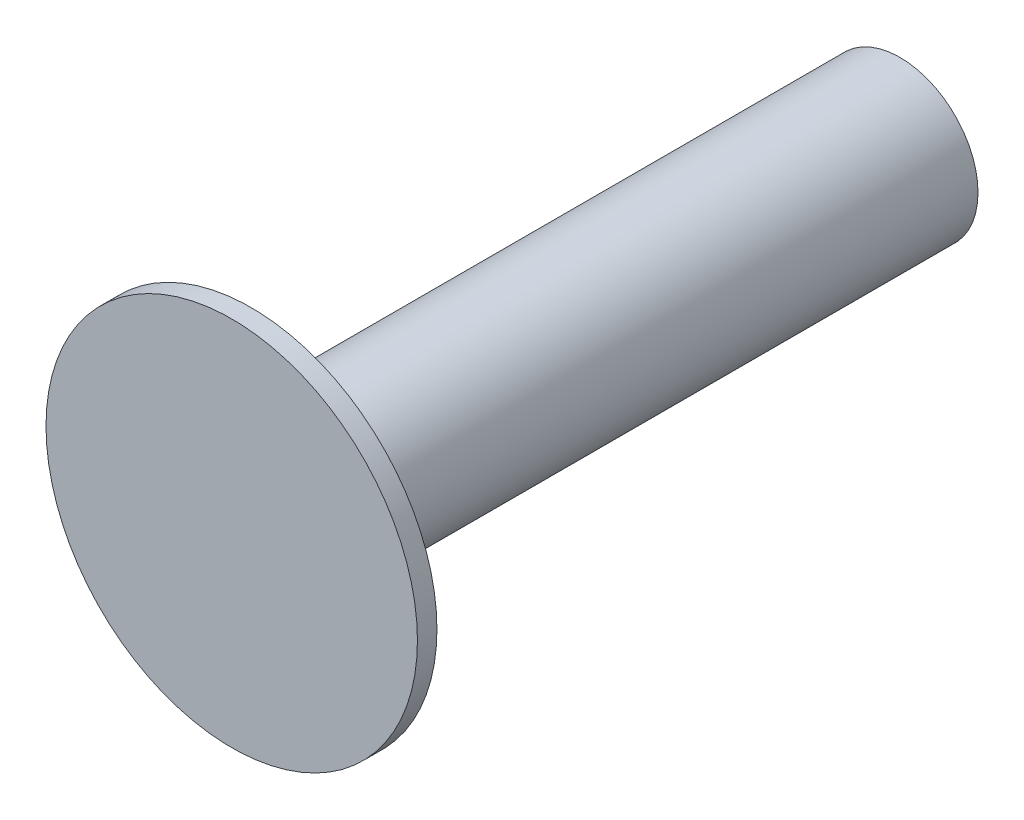
from build123d import *

# Parameters (mm, degrees)
SKETCH1_R           = 4
BOSS_EXTRUDE1_DEPTH = 33.274
SKETCH2_R           = 9.525
BOSS_EXTRUDE2_DEPTH = 1
SKETCH3_R           = 2
CUT_EXTRUDE1_DEPTH  = 15


with BuildPart() as part:
    # Sketch1 → Boss-Extrude1 (new body)
    with BuildSketch(Plane.XY):
        Circle(SKETCH1_R)
    extrude(amount=BOSS_EXTRUDE1_DEPTH)

    # Sketch2 → Boss-Extrude2 (add)
    with BuildSketch(Plane.XY.offset(33.274)):
        Circle(SKETCH2_R)
    extrude(amount=BOSS_EXTRUDE2_DEPTH)

    # Sketch3 → Cut-Extrude1 (cut)
    with BuildSketch(Plane(origin=(0, 0, 0), x_dir=(-1, 0, 0), z_dir=(0, 0, -1))):
        Circle(SKETCH3_R)
    extrude(amount=-CUT_EXTRUDE1_DEPTH, mode=Mode.SUBTRACT)


solid = part.part
